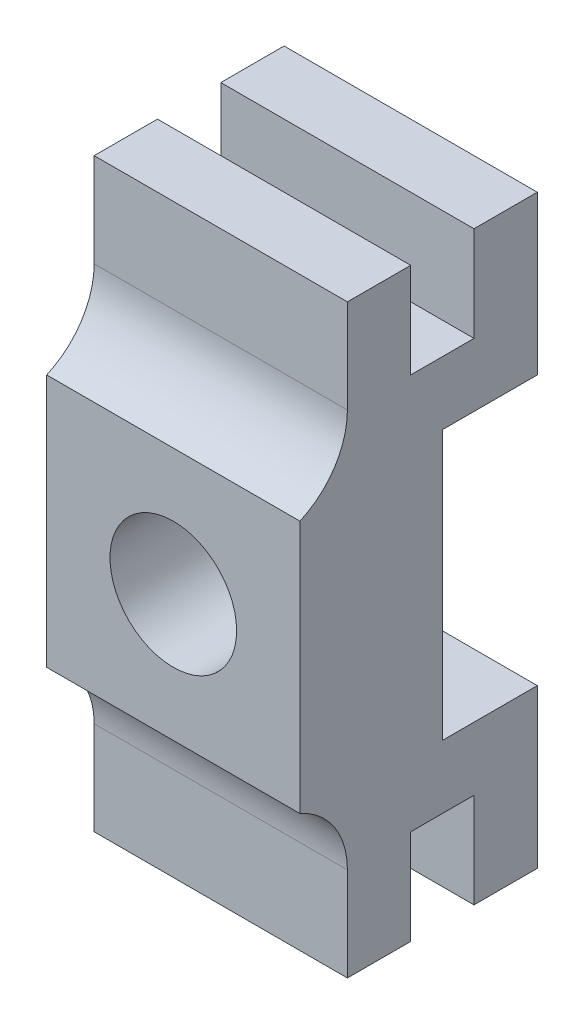
from build123d import *

# Parameters (mm, degrees)
BOSS_EXTRUDE1_DEPTH     = 8
CUT_EXTRUDE1_DEPTH      = 26.124689053
CUT_EXTRUDE1_DEPTH_BACK = 26.124689053
SKETCH2_R               = 4


with BuildPart() as part:
    # Sketch1 → Boss-Extrude1 (new, symmetric)
    with BuildSketch(Plane.YZ):
        with BuildLine():
            Line((8, 9), (-8, 9))
            ThreePointArc((-8, 9), (-9.843962907, 6.816699867), (-12.582575695, 6))
            Line((-12.582575695, 6), (-18.5, 6))
            Line((-18.5, 6), (-18.5, 2))
            Line((-18.5, 2), (-12.5, 2))
            Line((-12.5, 2), (-12.5, -2))
            Line((-12.5, -2), (-18.5, -2))
            Line((-18.5, -2), (-18.5, -6))
            Line((-18.5, -6), (-8.5, -6))
            Line((-8.5, -6), (-8.5, 0))
            Line((-8.5, 0), (8.5, 0))
            Line((8.5, 0), (8.5, -6))
            Line((8.5, -6), (18.5, -6))
            Line((18.5, -6), (18.5, -2))
            Line((18.5, -2), (12.5, -2))
            Line((12.5, -2), (12.5, 2))
            Line((12.5, 2), (18.5, 2))
            Line((18.5, 2), (18.5, 6))
            Line((18.5, 6), (12.582575695, 6))
            ThreePointArc((12.582575695, 6), (9.843962907, 6.816699867), (8, 9))
        make_face()
    extrude(amount=BOSS_EXTRUDE1_DEPTH, both=True)

    # Sketch2 → Cut-Extrude1 (cut, two sides: drawn at the far end of the back side and taken through both)
    with BuildSketch(Plane.XY.offset(9).offset(-CUT_EXTRUDE1_DEPTH_BACK)):
        Circle(SKETCH2_R)
    extrude(amount=CUT_EXTRUDE1_DEPTH + CUT_EXTRUDE1_DEPTH_BACK, mode=Mode.SUBTRACT)


solid = part.part
